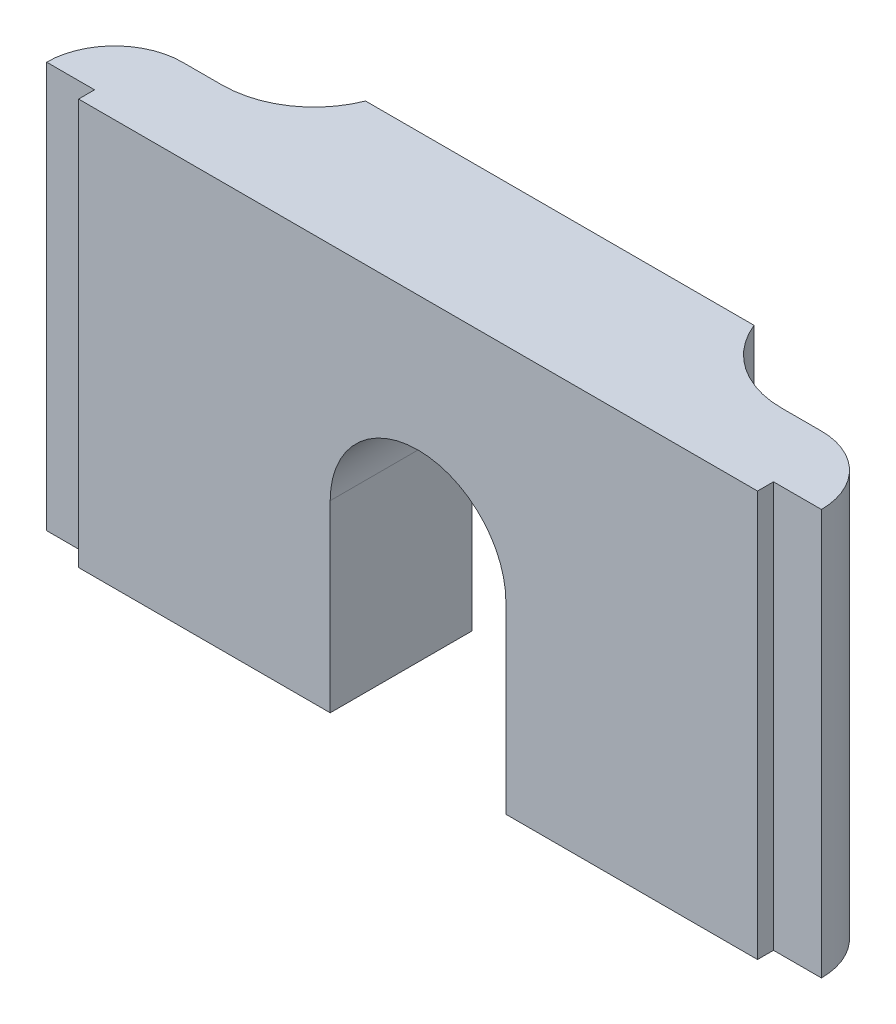
from build123d import *

# Parameters (mm, degrees)
BOSS_EXTRUDE1_DEPTH = 50.8
CUT_EXTRUDE1_DEPTH  = 73.442753019


with BuildPart() as part:
    # Sketch1 → Boss-Extrude1 (new body)
    with BuildSketch(Plane(origin=(0, 0, 0), x_dir=(1, 0, 0), z_dir=(0, 1, 0))):
        with BuildLine():
            Line((-24.319267033, 0), (24.319267033, 0))
            ThreePointArc((24.319267033, 0), (28.548536331, -5.266433952), (35.005122624, -7.250001141))
            Line((35.005122624, -7.250001141), (40, -7.250001141))
            ThreePointArc((40, -7.250001141), (46.010407237, -9.739593334), (48.49999943, -15.75000057))
            Line((48.49999943, -15.75000057), (42.49999943, -15.75000057))
            Line((42.49999943, -15.75000057), (42.49999943, -17.75000057))
            Line((42.49999943, -17.75000057), (-42.49999943, -17.75000057))
            Line((-42.49999943, -17.75000057), (-42.49999943, -15.75000057))
            Line((-42.49999943, -15.75000057), (-48.49999943, -15.75000057))
            ThreePointArc((-48.49999943, -15.75000057), (-46.010407237, -9.739593334), (-40, -7.250001141))
            Line((-40, -7.250001141), (-35.005122624, -7.250001141))
            ThreePointArc((-35.005122624, -7.250001141), (-28.548536331, -5.266433952), (-24.319267033, 0))
        make_face()
    extrude(amount=BOSS_EXTRUDE1_DEPTH)

    # Sketch3 → Cut-Extrude1 (cut, through all)
    with BuildSketch(Plane.XY.offset(17.75000057)):
        with BuildLine():
            Line((-11, 23), (-11, 0))
            Line((-11, 0), (11, 0))
            Line((11, 0), (11, 23))
            ThreePointArc((11, 23), (0, 34), (-11, 23))
        make_face()
    extrude(amount=-CUT_EXTRUDE1_DEPTH, mode=Mode.SUBTRACT)


solid = part.part
